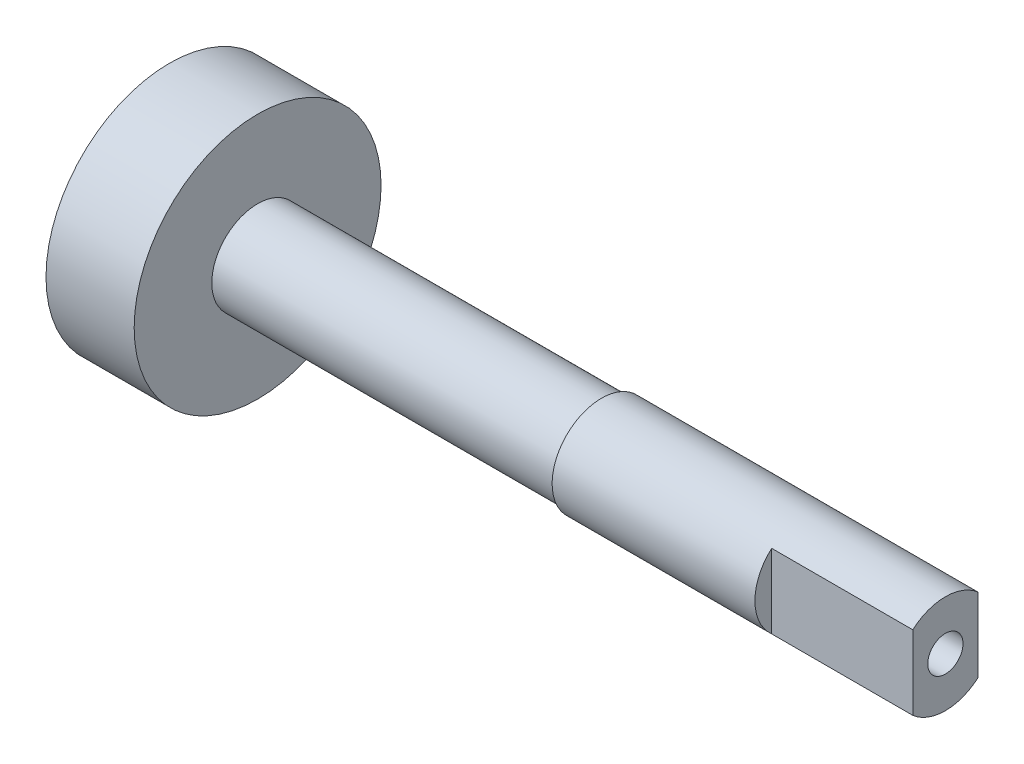
from build123d import *

# Parameters (mm, degrees)
SKETCH1_R           = 2.8
BOSS_EXTRUDE1_DEPTH = 19.5
CUT_EXTRUDE1_DEPTH  = 8
SKETCH3_R           = 1
CUT_EXTRUDE2_DEPTH  = 6
SKETCH5_R           = 7
BOSS_EXTRUDE2_DEPTH = 5
SKETCH7_R           = 2.9
SKETCH7_R_2         = 2.6
CUT_EXTRUDE3_DEPTH  = 19.5


with BuildPart() as part:
    # Sketch1 → Boss-Extrude1 (new, symmetric)
    with BuildSketch(Plane(origin=(0, 0, 0), x_dir=(0, 0, -1), z_dir=(1, 0, 0))):
        Circle(SKETCH1_R)
    extrude(amount=BOSS_EXTRUDE1_DEPTH, both=True)

    # Sketch2 → Cut-Extrude1 (cut)
    with BuildSketch(Plane(origin=(19.5, 0, 0), x_dir=(0, 0, -1), z_dir=(1, 0, 0))):
        with BuildLine():
            Line((-1.85, 2.101784956), (-1.85, -2.101784956))
            ThreePointArc((-1.85, -2.101784956), (-2.8, 0), (-1.85, 2.101784956))
        make_face()
        with BuildLine():
            Line((1.85, 2.101784956), (1.85, -2.101784956))
            ThreePointArc((1.85, -2.101784956), (2.8, 0), (1.85, 2.101784956))
        make_face()
    extrude(amount=-CUT_EXTRUDE1_DEPTH, mode=Mode.SUBTRACT)

    # Sketch3 → Cut-Extrude2 (cut)
    with BuildSketch(Plane(origin=(19.5, 0, 0), x_dir=(0, 0, -1), z_dir=(1, 0, 0))):
        Circle(SKETCH3_R)
    extrude(amount=-CUT_EXTRUDE2_DEPTH, mode=Mode.SUBTRACT)

    # Sketch5 → Boss-Extrude2 (add)
    with BuildSketch(Plane.ZY.offset(19.5)):
        Circle(SKETCH5_R)
    extrude(amount=BOSS_EXTRUDE2_DEPTH)

    # Sketch7 → Cut-Extrude3 (cut)
    with BuildSketch(Plane(origin=(0, 0, 0), x_dir=(0, 0, -1), z_dir=(1, 0, 0))):
        Circle(SKETCH7_R)
        Circle(SKETCH7_R_2, mode=Mode.SUBTRACT)
    extrude(amount=-CUT_EXTRUDE3_DEPTH, mode=Mode.SUBTRACT)


solid = part.part
